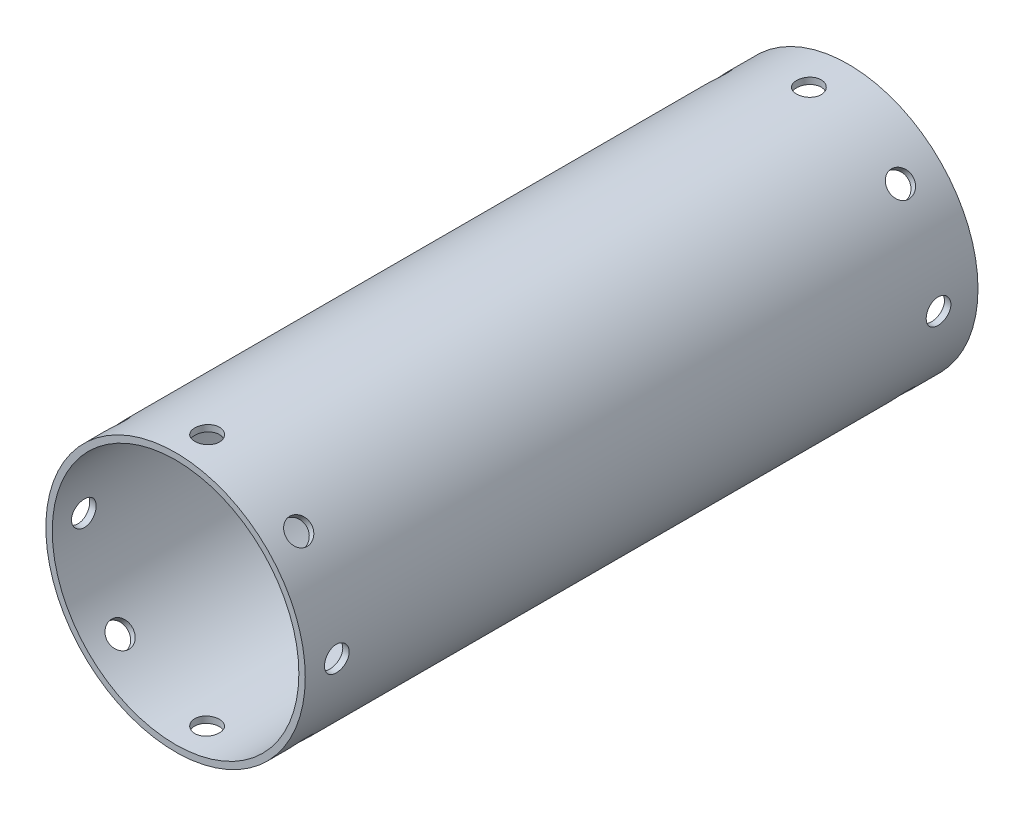
from build123d import *

# Parameters (mm, degrees)
SKETCH1_R                      = 33.401
SKETCH1_R_2                    = 31.75
BOSS_EXTRUDE1_DEPTH            = 173.228
CUT_EXTRUDE1_REACH             = 181.553
SKETCH2_R                      = 3.175
CUT_EXTRUDE1_DIRECTION_2_DEPTH = 1
LPATTERN1_COUNT                = 2
LPATTERN1_PITCH                = 154.94
CIRPATTERN2_COPY_1_REACH       = 181.553
CIRPATTERN2_COPY_1_SKETCH_R    = 3.175
CIRPATTERN2_COPY_2_REACH       = 181.553
CIRPATTERN2_COPY_2_SKETCH_R    = 3.175
CIRPATTERN2_COPY_3_REACH       = 181.553
CIRPATTERN2_COPY_3_SKETCH_R    = 3.175
CIRPATTERN2_COPY_4_REACH       = 181.553
CIRPATTERN2_COPY_4_SKETCH_R    = 3.175
CIRPATTERN2_COPY_5_REACH       = 181.553
CIRPATTERN2_COPY_5_SKETCH_R    = 3.175
CIRPATTERN2_COPY_6_REACH       = 181.553
CIRPATTERN2_COPY_6_SKETCH_R    = 3.175
CIRPATTERN2_COPY_7_REACH       = 181.553
CIRPATTERN2_COPY_7_SKETCH_R    = 3.175
CIRPATTERN2_COPY_8_SKETCH_R    = 3.175
CIRPATTERN2_COPY_8_DEPTH       = 1
CIRPATTERN2_COPY_9_SKETCH_R    = 3.175
CIRPATTERN2_COPY_9_DEPTH       = 1
CIRPATTERN2_COPY_10_SKETCH_R   = 3.175
CIRPATTERN2_COPY_10_DEPTH      = 1
CIRPATTERN2_COPY_11_SKETCH_R   = 3.175
CIRPATTERN2_COPY_11_DEPTH      = 1
CIRPATTERN2_COPY_12_SKETCH_R   = 3.175
CIRPATTERN2_COPY_12_DEPTH      = 1
CIRPATTERN2_COPY_13_SKETCH_R   = 3.175
CIRPATTERN2_COPY_13_DEPTH      = 1
CIRPATTERN2_COPY_14_SKETCH_R   = 3.175
CIRPATTERN2_COPY_14_DEPTH      = 1
CIRPATTERN2_COPY_15_REACH      = 181.553
CIRPATTERN2_COPY_15_SKETCH_R   = 3.175
CIRPATTERN2_COPY_16_REACH      = 181.553
CIRPATTERN2_COPY_16_SKETCH_R   = 3.175
CIRPATTERN2_COPY_17_REACH      = 181.553
CIRPATTERN2_COPY_17_SKETCH_R   = 3.175
CIRPATTERN2_COPY_18_REACH      = 181.553
CIRPATTERN2_COPY_18_SKETCH_R   = 3.175
CIRPATTERN2_COPY_19_REACH      = 181.553
CIRPATTERN2_COPY_19_SKETCH_R   = 3.175
CIRPATTERN2_COPY_20_REACH      = 181.553
CIRPATTERN2_COPY_20_SKETCH_R   = 3.175
CIRPATTERN2_COPY_21_REACH      = 181.553
CIRPATTERN2_COPY_21_SKETCH_R   = 3.175
CIRPATTERN2_COPY_22_SKETCH_R   = 3.175
CIRPATTERN2_COPY_22_DEPTH      = 1
CIRPATTERN2_COPY_23_SKETCH_R   = 3.175
CIRPATTERN2_COPY_23_DEPTH      = 1
CIRPATTERN2_COPY_24_SKETCH_R   = 3.175
CIRPATTERN2_COPY_24_DEPTH      = 1
CIRPATTERN2_COPY_25_SKETCH_R   = 3.175
CIRPATTERN2_COPY_25_DEPTH      = 1
CIRPATTERN2_COPY_26_SKETCH_R   = 3.175
CIRPATTERN2_COPY_26_DEPTH      = 1
CIRPATTERN2_COPY_27_SKETCH_R   = 3.175
CIRPATTERN2_COPY_27_DEPTH      = 1
CIRPATTERN2_COPY_28_SKETCH_R   = 3.175
CIRPATTERN2_COPY_28_DEPTH      = 1


with BuildPart() as part:
    # Sketch1 → Boss-Extrude1 (new body)
    with BuildSketch(Plane.XY):
        Circle(SKETCH1_R)
        Circle(SKETCH1_R_2, mode=Mode.SUBTRACT)
    extrude(amount=BOSS_EXTRUDE1_DEPTH)

    # Sketch2 → Cut-Extrude1 (cut, up to next)
    with BuildSketch(Plane(origin=(0, 0, 0), x_dir=(1, 0, 0), z_dir=(0, 1, 0)), mode=Mode.PRIVATE) as cut_extrude1_sk1:
        with Locations((0, -10.16)):
            Circle(SKETCH2_R)
    cut_extrude1_tool1 = extrude(cut_extrude1_sk1.sketch, amount=-CUT_EXTRUDE1_REACH, mode=Mode.PRIVATE) & part.part
    cut_extrude1 = cut_extrude1_tool1.solids().sort_by_distance((0, 0, 10.16))[0]
    add(cut_extrude1, mode=Mode.SUBTRACT)

    # Sketch2 → Cut-Extrude1 direction 2 (cut)
    with BuildSketch(Plane(origin=(0, 0, 0), x_dir=(1, 0, 0), z_dir=(0, 1, 0))):
        with Locations((0, -10.16)):
            Circle(SKETCH2_R)
    cut_extrude1_direction_2 = extrude(amount=CUT_EXTRUDE1_DIRECTION_2_DEPTH, mode=Mode.SUBTRACT)

    # LPattern1: Cut-Extrude1, Cut-Extrude1 direction 2 ×2
    with Locations(*[(0, 0, i * LPATTERN1_PITCH) for i in range(1, LPATTERN1_COUNT)]):
        add(cut_extrude1, mode=Mode.SUBTRACT)
        add(cut_extrude1_direction_2, mode=Mode.SUBTRACT)

    # CirPattern2 copy 1 sketch → CirPattern2 copy 1 (cut, up to next)
    with BuildSketch(Plane(origin=(0, 0, 154.94), x_dir=(0.7071067811865476, -0.7071067811865475, 0), z_dir=(0.7071067811865475, 0.7071067811865476, 0)), mode=Mode.PRIVATE) as cirpattern2_copy_1_sk1:
        with Locations((0, -10.16)):
            Circle(CIRPATTERN2_COPY_1_SKETCH_R)
    cirpattern2_copy_1_tool1 = extrude(cirpattern2_copy_1_sk1.sketch, amount=-CIRPATTERN2_COPY_1_REACH, mode=Mode.PRIVATE) & part.part
    add(cirpattern2_copy_1_tool1.solids().sort_by_distance((0, 0, 165.1))[0], mode=Mode.SUBTRACT)

    # CirPattern2 copy 2 sketch → CirPattern2 copy 2 (cut, up to next)
    with BuildSketch(Plane(origin=(0, 0, 154.94), x_dir=(0, -1, 0), z_dir=(1, 0, 0)), mode=Mode.PRIVATE) as cirpattern2_copy_2_sk1:
        with Locations((0, -10.16)):
            Circle(CIRPATTERN2_COPY_2_SKETCH_R)
    cirpattern2_copy_2_tool1 = extrude(cirpattern2_copy_2_sk1.sketch, amount=-CIRPATTERN2_COPY_2_REACH, mode=Mode.PRIVATE) & part.part
    add(cirpattern2_copy_2_tool1.solids().sort_by_distance((0, 0, 165.1))[0], mode=Mode.SUBTRACT)

    # CirPattern2 copy 3 sketch → CirPattern2 copy 3 (cut, up to next)
    with BuildSketch(Plane(origin=(0, 0, 154.94), x_dir=(-0.7071067811865475, -0.7071067811865476, 0), z_dir=(0.7071067811865476, -0.7071067811865475, 0)), mode=Mode.PRIVATE) as cirpattern2_copy_3_sk1:
        with Locations((0, -10.16)):
            Circle(CIRPATTERN2_COPY_3_SKETCH_R)
    cirpattern2_copy_3_tool1 = extrude(cirpattern2_copy_3_sk1.sketch, amount=-CIRPATTERN2_COPY_3_REACH, mode=Mode.PRIVATE) & part.part
    add(cirpattern2_copy_3_tool1.solids().sort_by_distance((0, 0, 165.1))[0], mode=Mode.SUBTRACT)

    # CirPattern2 copy 4 sketch → CirPattern2 copy 4 (cut, up to next)
    with BuildSketch(Plane(origin=(0, 0, 154.94), x_dir=(-1, 0, 0), z_dir=(0, -1, 0)), mode=Mode.PRIVATE) as cirpattern2_copy_4_sk1:
        with Locations((0, -10.16)):
            Circle(CIRPATTERN2_COPY_4_SKETCH_R)
    cirpattern2_copy_4_tool1 = extrude(cirpattern2_copy_4_sk1.sketch, amount=-CIRPATTERN2_COPY_4_REACH, mode=Mode.PRIVATE) & part.part
    add(cirpattern2_copy_4_tool1.solids().sort_by_distance((0, 0, 165.1))[0], mode=Mode.SUBTRACT)

    # CirPattern2 copy 5 sketch → CirPattern2 copy 5 (cut, up to next)
    with BuildSketch(Plane(origin=(0, 0, 154.94), x_dir=(-0.7071067811865477, 0.7071067811865475, 0), z_dir=(-0.7071067811865475, -0.7071067811865477, 0)), mode=Mode.PRIVATE) as cirpattern2_copy_5_sk1:
        with Locations((0, -10.16)):
            Circle(CIRPATTERN2_COPY_5_SKETCH_R)
    cirpattern2_copy_5_tool1 = extrude(cirpattern2_copy_5_sk1.sketch, amount=-CIRPATTERN2_COPY_5_REACH, mode=Mode.PRIVATE) & part.part
    add(cirpattern2_copy_5_tool1.solids().sort_by_distance((0, 0, 165.1))[0], mode=Mode.SUBTRACT)

    # CirPattern2 copy 6 sketch → CirPattern2 copy 6 (cut, up to next)
    with BuildSketch(Plane(origin=(0, 0, 154.94), x_dir=(0, 1, 0), z_dir=(-1, 0, 0)), mode=Mode.PRIVATE) as cirpattern2_copy_6_sk1:
        with Locations((0, -10.16)):
            Circle(CIRPATTERN2_COPY_6_SKETCH_R)
    cirpattern2_copy_6_tool1 = extrude(cirpattern2_copy_6_sk1.sketch, amount=-CIRPATTERN2_COPY_6_REACH, mode=Mode.PRIVATE) & part.part
    add(cirpattern2_copy_6_tool1.solids().sort_by_distance((0, 0, 165.1))[0], mode=Mode.SUBTRACT)

    # CirPattern2 copy 7 sketch → CirPattern2 copy 7 (cut, up to next)
    with BuildSketch(Plane(origin=(0, 0, 154.94), x_dir=(0.7071067811865474, 0.7071067811865477, 0), z_dir=(-0.7071067811865477, 0.7071067811865474, 0)), mode=Mode.PRIVATE) as cirpattern2_copy_7_sk1:
        with Locations((0, -10.16)):
            Circle(CIRPATTERN2_COPY_7_SKETCH_R)
    cirpattern2_copy_7_tool1 = extrude(cirpattern2_copy_7_sk1.sketch, amount=-CIRPATTERN2_COPY_7_REACH, mode=Mode.PRIVATE) & part.part
    add(cirpattern2_copy_7_tool1.solids().sort_by_distance((0, 0, 165.1))[0], mode=Mode.SUBTRACT)

    # CirPattern2 copy 8 sketch → CirPattern2 copy 8 (cut)
    with BuildSketch(Plane(origin=(0, 0, 154.94), x_dir=(0.7071067811865476, -0.7071067811865475, 0), z_dir=(0.7071067811865475, 0.7071067811865476, 0))):
        with Locations((0, -10.16)):
            Circle(CIRPATTERN2_COPY_8_SKETCH_R)
    extrude(amount=CIRPATTERN2_COPY_8_DEPTH, mode=Mode.SUBTRACT)

    # CirPattern2 copy 9 sketch → CirPattern2 copy 9 (cut)
    with BuildSketch(Plane(origin=(0, 0, 154.94), x_dir=(0, -1, 0), z_dir=(1, 0, 0))):
        with Locations((0, -10.16)):
            Circle(CIRPATTERN2_COPY_9_SKETCH_R)
    extrude(amount=CIRPATTERN2_COPY_9_DEPTH, mode=Mode.SUBTRACT)

    # CirPattern2 copy 10 sketch → CirPattern2 copy 10 (cut)
    with BuildSketch(Plane(origin=(0, 0, 154.94), x_dir=(-0.7071067811865475, -0.7071067811865476, 0), z_dir=(0.7071067811865476, -0.7071067811865475, 0))):
        with Locations((0, -10.16)):
            Circle(CIRPATTERN2_COPY_10_SKETCH_R)
    extrude(amount=CIRPATTERN2_COPY_10_DEPTH, mode=Mode.SUBTRACT)

    # CirPattern2 copy 11 sketch → CirPattern2 copy 11 (cut)
    with BuildSketch(Plane(origin=(0, 0, 154.94), x_dir=(-1, 0, 0), z_dir=(0, -1, 0))):
        with Locations((0, -10.16)):
            Circle(CIRPATTERN2_COPY_11_SKETCH_R)
    extrude(amount=CIRPATTERN2_COPY_11_DEPTH, mode=Mode.SUBTRACT)

    # CirPattern2 copy 12 sketch → CirPattern2 copy 12 (cut)
    with BuildSketch(Plane(origin=(0, 0, 154.94), x_dir=(-0.7071067811865477, 0.7071067811865475, 0), z_dir=(-0.7071067811865475, -0.7071067811865477, 0))):
        with Locations((0, -10.16)):
            Circle(CIRPATTERN2_COPY_12_SKETCH_R)
    extrude(amount=CIRPATTERN2_COPY_12_DEPTH, mode=Mode.SUBTRACT)

    # CirPattern2 copy 13 sketch → CirPattern2 copy 13 (cut)
    with BuildSketch(Plane(origin=(0, 0, 154.94), x_dir=(0, 1, 0), z_dir=(-1, 0, 0))):
        with Locations((0, -10.16)):
            Circle(CIRPATTERN2_COPY_13_SKETCH_R)
    extrude(amount=CIRPATTERN2_COPY_13_DEPTH, mode=Mode.SUBTRACT)

    # CirPattern2 copy 14 sketch → CirPattern2 copy 14 (cut)
    with BuildSketch(Plane(origin=(0, 0, 154.94), x_dir=(0.7071067811865474, 0.7071067811865477, 0), z_dir=(-0.7071067811865477, 0.7071067811865474, 0))):
        with Locations((0, -10.16)):
            Circle(CIRPATTERN2_COPY_14_SKETCH_R)
    extrude(amount=CIRPATTERN2_COPY_14_DEPTH, mode=Mode.SUBTRACT)

    # CirPattern2 copy 15 sketch → CirPattern2 copy 15 (cut, up to next)
    with BuildSketch(Plane(origin=(0, 0, 0), x_dir=(0.7071067811865476, -0.7071067811865475, 0), z_dir=(0.7071067811865475, 0.7071067811865476, 0)), mode=Mode.PRIVATE) as cirpattern2_copy_15_sk1:
        with Locations((0, -10.16)):
            Circle(CIRPATTERN2_COPY_15_SKETCH_R)
    cirpattern2_copy_15_tool1 = extrude(cirpattern2_copy_15_sk1.sketch, amount=-CIRPATTERN2_COPY_15_REACH, mode=Mode.PRIVATE) & part.part
    add(cirpattern2_copy_15_tool1.solids().sort_by_distance((0, 0, 10.16))[0], mode=Mode.SUBTRACT)

    # CirPattern2 copy 16 sketch → CirPattern2 copy 16 (cut, up to next)
    with BuildSketch(Plane(origin=(0, 0, 0), x_dir=(0, -1, 0), z_dir=(1, 0, 0)), mode=Mode.PRIVATE) as cirpattern2_copy_16_sk1:
        with Locations((0, -10.16)):
            Circle(CIRPATTERN2_COPY_16_SKETCH_R)
    cirpattern2_copy_16_tool1 = extrude(cirpattern2_copy_16_sk1.sketch, amount=-CIRPATTERN2_COPY_16_REACH, mode=Mode.PRIVATE) & part.part
    add(cirpattern2_copy_16_tool1.solids().sort_by_distance((0, 0, 10.16))[0], mode=Mode.SUBTRACT)

    # CirPattern2 copy 17 sketch → CirPattern2 copy 17 (cut, up to next)
    with BuildSketch(Plane(origin=(0, 0, 0), x_dir=(-0.7071067811865475, -0.7071067811865476, 0), z_dir=(0.7071067811865476, -0.7071067811865475, 0)), mode=Mode.PRIVATE) as cirpattern2_copy_17_sk1:
        with Locations((0, -10.16)):
            Circle(CIRPATTERN2_COPY_17_SKETCH_R)
    cirpattern2_copy_17_tool1 = extrude(cirpattern2_copy_17_sk1.sketch, amount=-CIRPATTERN2_COPY_17_REACH, mode=Mode.PRIVATE) & part.part
    add(cirpattern2_copy_17_tool1.solids().sort_by_distance((0, 0, 10.16))[0], mode=Mode.SUBTRACT)

    # CirPattern2 copy 18 sketch → CirPattern2 copy 18 (cut, up to next)
    with BuildSketch(Plane(origin=(0, 0, 0), x_dir=(-1, 0, 0), z_dir=(0, -1, 0)), mode=Mode.PRIVATE) as cirpattern2_copy_18_sk1:
        with Locations((0, -10.16)):
            Circle(CIRPATTERN2_COPY_18_SKETCH_R)
    cirpattern2_copy_18_tool1 = extrude(cirpattern2_copy_18_sk1.sketch, amount=-CIRPATTERN2_COPY_18_REACH, mode=Mode.PRIVATE) & part.part
    add(cirpattern2_copy_18_tool1.solids().sort_by_distance((0, 0, 10.16))[0], mode=Mode.SUBTRACT)

    # CirPattern2 copy 19 sketch → CirPattern2 copy 19 (cut, up to next)
    with BuildSketch(Plane(origin=(0, 0, 0), x_dir=(-0.7071067811865477, 0.7071067811865475, 0), z_dir=(-0.7071067811865475, -0.7071067811865477, 0)), mode=Mode.PRIVATE) as cirpattern2_copy_19_sk1:
        with Locations((0, -10.16)):
            Circle(CIRPATTERN2_COPY_19_SKETCH_R)
    cirpattern2_copy_19_tool1 = extrude(cirpattern2_copy_19_sk1.sketch, amount=-CIRPATTERN2_COPY_19_REACH, mode=Mode.PRIVATE) & part.part
    add(cirpattern2_copy_19_tool1.solids().sort_by_distance((0, 0, 10.16))[0], mode=Mode.SUBTRACT)

    # CirPattern2 copy 20 sketch → CirPattern2 copy 20 (cut, up to next)
    with BuildSketch(Plane(origin=(0, 0, 0), x_dir=(0, 1, 0), z_dir=(-1, 0, 0)), mode=Mode.PRIVATE) as cirpattern2_copy_20_sk1:
        with Locations((0, -10.16)):
            Circle(CIRPATTERN2_COPY_20_SKETCH_R)
    cirpattern2_copy_20_tool1 = extrude(cirpattern2_copy_20_sk1.sketch, amount=-CIRPATTERN2_COPY_20_REACH, mode=Mode.PRIVATE) & part.part
    add(cirpattern2_copy_20_tool1.solids().sort_by_distance((0, 0, 10.16))[0], mode=Mode.SUBTRACT)

    # CirPattern2 copy 21 sketch → CirPattern2 copy 21 (cut, up to next)
    with BuildSketch(Plane(origin=(0, 0, 0), x_dir=(0.7071067811865474, 0.7071067811865477, 0), z_dir=(-0.7071067811865477, 0.7071067811865474, 0)), mode=Mode.PRIVATE) as cirpattern2_copy_21_sk1:
        with Locations((0, -10.16)):
            Circle(CIRPATTERN2_COPY_21_SKETCH_R)
    cirpattern2_copy_21_tool1 = extrude(cirpattern2_copy_21_sk1.sketch, amount=-CIRPATTERN2_COPY_21_REACH, mode=Mode.PRIVATE) & part.part
    add(cirpattern2_copy_21_tool1.solids().sort_by_distance((0, 0, 10.16))[0], mode=Mode.SUBTRACT)

    # CirPattern2 copy 22 sketch → CirPattern2 copy 22 (cut)
    with BuildSketch(Plane(origin=(0, 0, 0), x_dir=(0.7071067811865476, -0.7071067811865475, 0), z_dir=(0.7071067811865475, 0.7071067811865476, 0))):
        with Locations((0, -10.16)):
            Circle(CIRPATTERN2_COPY_22_SKETCH_R)
    extrude(amount=CIRPATTERN2_COPY_22_DEPTH, mode=Mode.SUBTRACT)

    # CirPattern2 copy 23 sketch → CirPattern2 copy 23 (cut)
    with BuildSketch(Plane(origin=(0, 0, 0), x_dir=(0, -1, 0), z_dir=(1, 0, 0))):
        with Locations((0, -10.16)):
            Circle(CIRPATTERN2_COPY_23_SKETCH_R)
    extrude(amount=CIRPATTERN2_COPY_23_DEPTH, mode=Mode.SUBTRACT)

    # CirPattern2 copy 24 sketch → CirPattern2 copy 24 (cut)
    with BuildSketch(Plane(origin=(0, 0, 0), x_dir=(-0.7071067811865475, -0.7071067811865476, 0), z_dir=(0.7071067811865476, -0.7071067811865475, 0))):
        with Locations((0, -10.16)):
            Circle(CIRPATTERN2_COPY_24_SKETCH_R)
    extrude(amount=CIRPATTERN2_COPY_24_DEPTH, mode=Mode.SUBTRACT)

    # CirPattern2 copy 25 sketch → CirPattern2 copy 25 (cut)
    with BuildSketch(Plane(origin=(0, 0, 0), x_dir=(-1, 0, 0), z_dir=(0, -1, 0))):
        with Locations((0, -10.16)):
            Circle(CIRPATTERN2_COPY_25_SKETCH_R)
    extrude(amount=CIRPATTERN2_COPY_25_DEPTH, mode=Mode.SUBTRACT)

    # CirPattern2 copy 26 sketch → CirPattern2 copy 26 (cut)
    with BuildSketch(Plane(origin=(0, 0, 0), x_dir=(-0.7071067811865477, 0.7071067811865475, 0), z_dir=(-0.7071067811865475, -0.7071067811865477, 0))):
        with Locations((0, -10.16)):
            Circle(CIRPATTERN2_COPY_26_SKETCH_R)
    extrude(amount=CIRPATTERN2_COPY_26_DEPTH, mode=Mode.SUBTRACT)

    # CirPattern2 copy 27 sketch → CirPattern2 copy 27 (cut)
    with BuildSketch(Plane(origin=(0, 0, 0), x_dir=(0, 1, 0), z_dir=(-1, 0, 0))):
        with Locations((0, -10.16)):
            Circle(CIRPATTERN2_COPY_27_SKETCH_R)
    extrude(amount=CIRPATTERN2_COPY_27_DEPTH, mode=Mode.SUBTRACT)

    # CirPattern2 copy 28 sketch → CirPattern2 copy 28 (cut)
    with BuildSketch(Plane(origin=(0, 0, 0), x_dir=(0.7071067811865474, 0.7071067811865477, 0), z_dir=(-0.7071067811865477, 0.7071067811865474, 0))):
        with Locations((0, -10.16)):
            Circle(CIRPATTERN2_COPY_28_SKETCH_R)
    extrude(amount=CIRPATTERN2_COPY_28_DEPTH, mode=Mode.SUBTRACT)


solid = part.part
